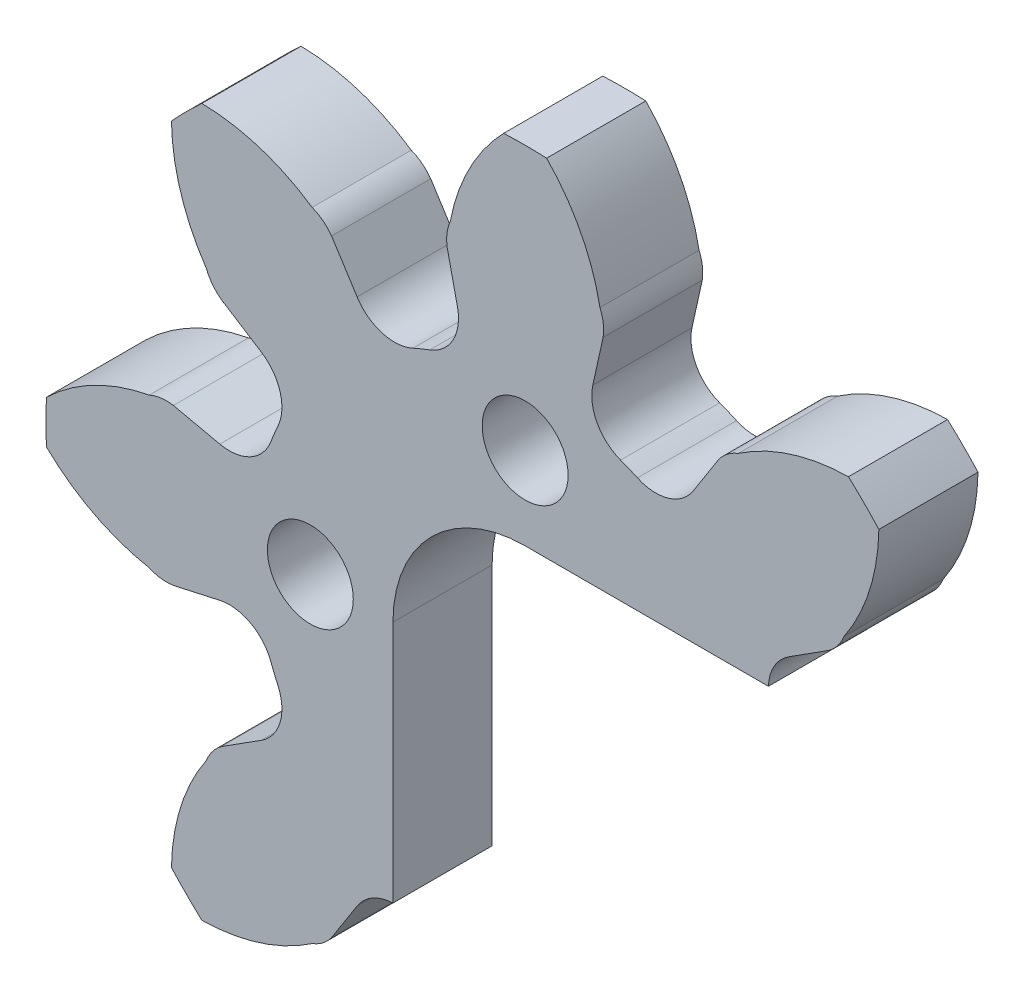
from build123d import *

# Parameters (mm, degrees)
POSICIONAMENTOS_R               = 8.2157
BASE_DEPTH                      = 3
FURO_DE_DI_METRO_2_6_2_6_1_D    = 2.6
BASE_DENTE_DEPTH                = 3
RAIO_DENTE_R                    = 1.342367201
PADR_OCIRCULAR1_COUNT           = 8
RAIO_DENTE_OF_PADR_OCIRCULAR1_R = 1.342367201
FURO_DE_DI_METRO_3_0_3_1_D      = 3
CORTE_EXTRUS_O1_DEPTH           = 21.724381776


with BuildPart() as part:
    # Posicionamentos → Base (new body)
    with BuildSketch(Plane.XY):
        Circle(POSICIONAMENTOS_R)
    extrude(amount=BASE_DEPTH)

    # Furo de diâmetro Ø2.6 (2.6)1 (through all)
    with Locations(Plane.XY.offset(3)):
        with Locations((0, 6.5), (-6.5, 0)):
            Hole(FURO_DE_DI_METRO_2_6_2_6_1_D / 2)

    # Dente → Base Dente (add, through all)
    with BuildSketch(Plane.XY):
        with BuildLine():
            Line((2.358922349, 10.642131153), (1.777928991, 8.021015833))
            ThreePointArc((1.777928991, 8.021015833), (0, 8.2157), (-1.777928991, 8.021015833))
            Line((-1.777928991, 8.021015833), (-2.358922349, 10.642131153))
            ThreePointArc((-2.358922349, 10.642131153), (-2.364262787, 11.016570047), (-2.263047735, 11.377109253))
            ThreePointArc((-2.263047735, 11.377109253), (-1.685191659, 13.049606095), (-0.650923694, 14.48538223))
            ThreePointArc((-0.650923694, 14.48538223), (0, 14.5), (0.650923694, 14.48538223))
            ThreePointArc((0.650923694, 14.48538223), (1.685191659, 13.049606095), (2.263047735, 11.377109253))
            ThreePointArc((2.263047735, 11.377109253), (2.364262787, 11.016570047), (2.358922349, 10.642131153))
        make_face()
    base_dente = extrude(amount=BASE_DENTE_DEPTH)

    # Raio Dente
    raio_dente_edges = [part.edges().sort_by_distance(p)[0] for p in [
        (-1.777928991, 8.021015833, 1.5),
        (1.777928991, 8.021015833, 1.5),
    ]]
    fillet(raio_dente_edges, radius=RAIO_DENTE_R)

    # PadrãoCircular1: Base Dente ×8 about axis
    padr_ocircular1_axis = Axis((0, 0, 0), (0, 0, 1))
    for i in range(1, PADR_OCIRCULAR1_COUNT):
        add(base_dente.rotate(padr_ocircular1_axis, i * 360 / PADR_OCIRCULAR1_COUNT))

    # Raio Dente of PadrãoCircular1
    raio_dente_of_padr_ocircular1_edges = [part.edges().sort_by_distance(p)[0] for p in [
        (-6.928900334, 4.414529041, 1.5),
        (-4.414529041, 6.928900334, 1.5),
        (-8.021015833, -1.777928991, 1.5),
        (-8.021015833, 1.777928991, 1.5),
        (-4.414529041, -6.928900334, 1.5),
        (-6.928900334, -4.414529041, 1.5),
        (1.777928991, -8.021015833, 1.5),
        (-1.777928991, -8.021015833, 1.5),
        (6.928900334, -4.414529041, 1.5),
        (4.414529041, -6.928900334, 1.5),
        (8.021015833, 1.777928991, 1.5),
        (8.021015833, -1.777928991, 1.5),
        (4.414529041, 6.928900334, 1.5),
        (6.928900334, 4.414529041, 1.5),
    ]]
    fillet(raio_dente_of_padr_ocircular1_edges, radius=RAIO_DENTE_OF_PADR_OCIRCULAR1_R)

    # Furo de diâmetro Ø3.0 (3)1 (through all)
    with Locations(Plane.XY.offset(3)):
        with Locations((0, 0)):
            Hole(FURO_DE_DI_METRO_3_0_3_1_D / 2)

    # Encaixe → Corte-extrusão1 (cut, through all)
    with BuildSketch(Plane.XY):
        with BuildLine():
            Line((-4, 0), (-4, -13.937359865))
            ThreePointArc((-4, -13.937359865), (10.253048327, -10.253048327), (13.937359865, 4))
            Line((13.937359865, 4), (0, 4))
            ThreePointArc((0, 4), (-2.828427125, 2.828427125), (-4, 0))
        make_face()
    extrude(amount=CORTE_EXTRUS_O1_DEPTH, mode=Mode.SUBTRACT)


solid = part.part
